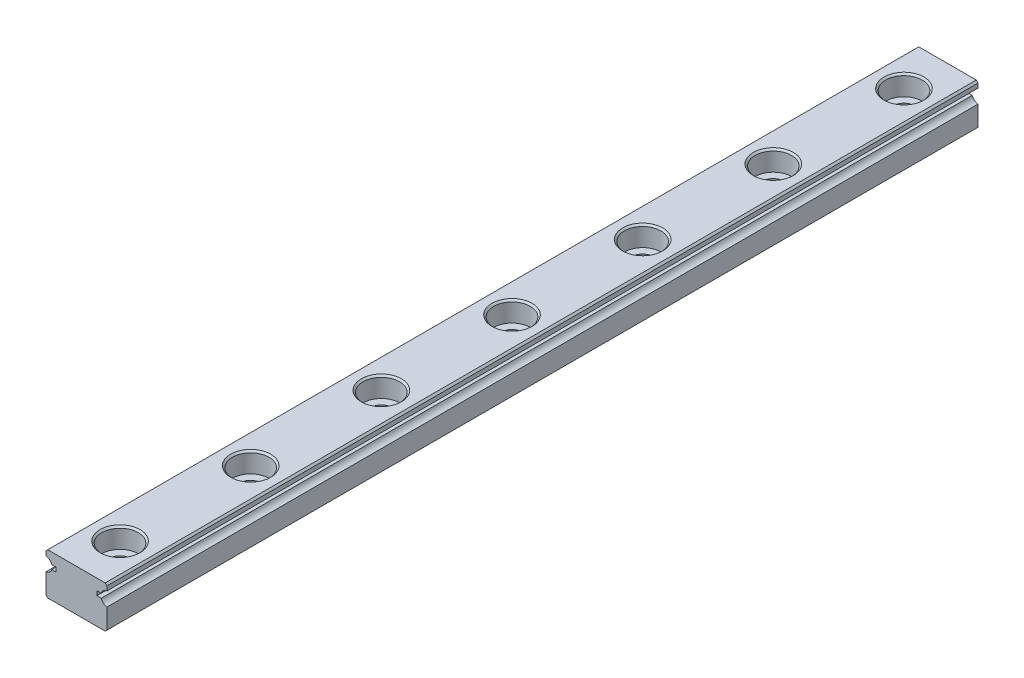
from build123d import *

# Parameters (mm, degrees)
EXTRUDE1_DEPTH             = 150
EXTRUDE2_REACH             = 152.118
SKETCH2_R                  = 1.2
SKETCH_R                   = 2.1
SKETCH_R_2                 = 1.2
EXTRUDE4_DEPTH             = 2.3
CHAMFER1_SIZE              = 0.2
LPATTERN1_COUNT            = 10
LPATTERN1_PITCH            = 15
CHAMFER1_OF_LPATTERN1_SIZE = 0.2
SKETCH3_W                  = 9.7061266
SKETCH3_H                  = 7.240457343
CUT_EXTRUDE2_DEPTH         = 30
SKETCH4_W                  = 8.375440404
SKETCH4_H                  = 5.803826308
CUT_EXTRUDE3_DEPTH         = 20


with BuildPart() as part:
    # Sketch1 → Extrude1 (new body)
    with BuildSketch(Plane.XY):
        with BuildLine():
            Line((-3.3, -2.4), (3.3, -2.4))
            Line((3.3, -2.4), (3.5, -2.2))
            Line((3.5, -2.2), (3.5, 0.106274607))
            ThreePointArc((3.5, 0.106274607), (3.091294745, 0.282570681), (2.840065792, 0.65))
            Line((2.840065792, 0.65), (2.340065792, 0.65))
            Line((2.340065792, 0.65), (2.340065792, 1.15))
            Line((2.340065792, 1.15), (2.840065792, 1.15))
            ThreePointArc((2.840065792, 1.15), (3.091294745, 1.517429319), (3.5, 1.693725393))
            Line((3.5, 1.693725393), (3.5, 2.2))
            Line((3.5, 2.2), (3.3, 2.4))
            Line((3.3, 2.4), (-3.3, 2.4))
            Line((-3.3, 2.4), (-3.5, 2.2))
            Line((-3.5, 2.2), (-3.5, 1.693725393))
            ThreePointArc((-3.5, 1.693725393), (-3.091294745, 1.517429319), (-2.840065792, 1.15))
            Line((-2.840065792, 1.15), (-2.340065792, 1.15))
            Line((-2.340065792, 1.15), (-2.340065792, 0.65))
            Line((-2.340065792, 0.65), (-2.840065792, 0.65))
            ThreePointArc((-2.840065792, 0.65), (-3.091294745, 0.282570681), (-3.5, 0.106274607))
            Line((-3.5, 0.106274607), (-3.5, -2.2))
            Line((-3.5, -2.2), (-3.3, -2.4))
        make_face()
    extrude(amount=EXTRUDE1_DEPTH)

    # Sketch2 → Extrude2 (cut, up to next)
    with BuildSketch(Plane(origin=(0, 2.4, 0), x_dir=(1, 0, 0), z_dir=(0, 1, 0)), mode=Mode.PRIVATE) as extrude2_sk1:
        with Locations((0, -5)):
            Circle(SKETCH2_R)
    extrude2_tool1 = extrude(extrude2_sk1.sketch, amount=-EXTRUDE2_REACH, mode=Mode.PRIVATE) & part.part
    extrude2 = extrude2_tool1.solids().sort_by_distance((0, 2.4, 5))[0]
    add(extrude2, mode=Mode.SUBTRACT)

    # Sketch → Extrude4 (cut)
    with BuildSketch(Plane(origin=(0, 2.4, 0), x_dir=(1, 0, 0), z_dir=(0, 1, 0))):
        with Locations((0, -5)):
            Circle(SKETCH_R)
        with Locations((0, -5)):
            Circle(SKETCH_R_2, mode=Mode.SUBTRACT)
    extrude4 = extrude(amount=-EXTRUDE4_DEPTH, mode=Mode.SUBTRACT)

    # Chamfer1
    chamfer1_edges = [part.edges().sort_by_distance(p)[0] for p in [
        (-1.2, -2.4, 5),
        (-2.1, 2.4, 5),
    ]]
    chamfer(chamfer1_edges, length=CHAMFER1_SIZE)

    # LPattern1: Extrude2, Extrude4 ×10
    with Locations(*[(0, 0, i * LPATTERN1_PITCH) for i in range(1, LPATTERN1_COUNT)]):
        add(extrude2, mode=Mode.SUBTRACT)
        add(extrude4, mode=Mode.SUBTRACT)

    # Chamfer1 of LPattern1
    chamfer1_of_lpattern1_edges = [part.edges().sort_by_distance(p)[0] for p in [
        (-1.2, -2.4, 20),
        (-2.1, 2.4, 20),
        (-1.2, -2.4, 35),
        (-2.1, 2.4, 35),
        (-1.2, -2.4, 50),
        (-2.1, 2.4, 50),
        (-1.2, -2.4, 65),
        (-2.1, 2.4, 65),
        (-1.2, -2.4, 80),
        (-2.1, 2.4, 80),
        (-1.2, -2.4, 95),
        (-2.1, 2.4, 95),
        (-1.2, -2.4, 110),
        (-2.1, 2.4, 110),
        (-1.2, -2.4, 125),
        (-2.1, 2.4, 125),
        (-1.2, -2.4, 140),
        (-2.1, 2.4, 140),
    ]]
    chamfer(chamfer1_of_lpattern1_edges, length=CHAMFER1_OF_LPATTERN1_SIZE)

    # Sketch3 → Cut-Extrude2 (cut)
    with BuildSketch(Plane(origin=(0, 0, 0), x_dir=(-1, 0, 0), z_dir=(0, 0, -1))):
        with Locations((-0.166334831, 0.38159167)):
            Rectangle(SKETCH3_W, SKETCH3_H)
    extrude(amount=-CUT_EXTRUDE2_DEPTH, mode=Mode.SUBTRACT)

    # Sketch4 → Cut-Extrude3 (cut)
    with BuildSketch(Plane.XY.offset(150)):
        with Locations((0.110099686, -0.019660658)):
            Rectangle(SKETCH4_W, SKETCH4_H)
    extrude(amount=-CUT_EXTRUDE3_DEPTH, mode=Mode.SUBTRACT)


solid = part.part
